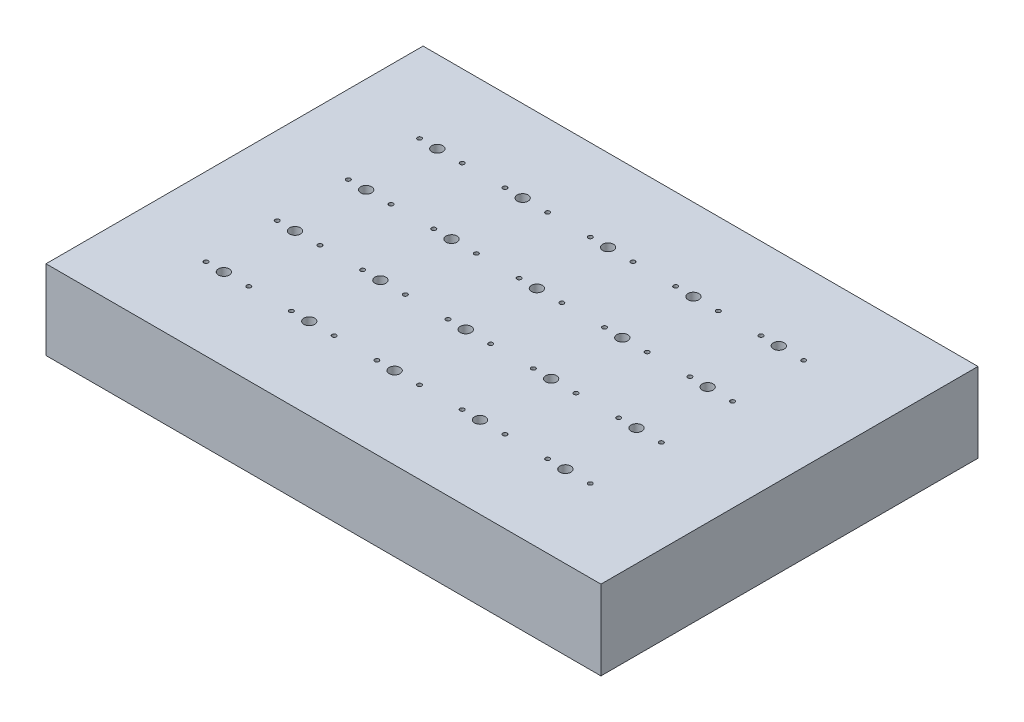
from build123d import *

# Parameters (mm, degrees)
BASEWITH_ALIGNMENT_W     = 70
BASEWITH_ALIGNMENT_H     = 45
BOSS_EXTRUDE1_DEPTH      = 3.175
BOSS_EXTRUDE2_DEPTH      = 3
SKETCH1_4_R              = 0.762
SKETCH1_4_R_2            = 0.3
CUT_EXTRUDE1_DEPTH       = 71.82605894
LPATTERN1_COUNT          = 4
LPATTERN1_PITCH          = 10
LPATTERN1_COUNT_DIR2     = 5
LPATTERN1_PITCH_DIR2     = 12
BOSS_EXTRUDE3_DEPTH      = 8
BOSS_EXTRUDE3_DEPTH_BACK = 3.175
SKETCH2_W                = 78
SKETCH2_H                = 53
SKETCH2_W_2              = 70
SKETCH2_H_2              = 45


with BuildPart() as part:
    # BaseWith Alignment → Boss-Extrude1 (new body)
    with BuildSketch(Plane(origin=(0, 0, 0), x_dir=(1, 0, 0), z_dir=(0, 1, 0))):
        with Locations((25, -15)):
            Rectangle(BASEWITH_ALIGNMENT_W, BASEWITH_ALIGNMENT_H)
    extrude(amount=BOSS_EXTRUDE1_DEPTH)

    # Sketch1 → Boss-Extrude2 (add)
    with BuildSketch(Plane(origin=(0, 0, 0), x_dir=(-1, 0, 0), z_dir=(0, -1, 0))):
        with BuildLine():
            Line((2.017857143, -1.961432458), (-3.110714286, -1.296526148))
            ThreePointArc((-3.110714286, -1.296526148), (-4.25, 0), (-3.110714286, 1.296526148))
            Line((-3.110714286, 1.296526148), (2.017857143, 1.961432458))
            ThreePointArc((2.017857143, 1.961432458), (4.25, 0), (2.017857143, -1.961432458))
        make_face()
    boss_extrude2 = extrude(amount=BOSS_EXTRUDE2_DEPTH)

    # Sketch1<4> → Cut-Extrude1 (cut, symmetric)
    with BuildSketch(Plane(origin=(0, 0, 0), x_dir=(-1, 0, 0), z_dir=(0, -1, 0))):
        with Locations(Location((0.5, 0, 0), (0, 0, 90))):
            Circle(SKETCH1_4_R)
        with Locations(Location((3, 0, 0), (0, 0, 90))):
            Circle(SKETCH1_4_R_2)
        with Locations(Location((-3, 0, 0), (0, 0, 90))):
            Circle(SKETCH1_4_R_2)
    cut_extrude1 = extrude(amount=CUT_EXTRUDE1_DEPTH, both=True, mode=Mode.SUBTRACT)

    # LPattern1: Boss-Extrude2, Cut-Extrude1 4 × 5
    with Locations(*[(j * LPATTERN1_PITCH_DIR2, 0, i * LPATTERN1_PITCH) for i in range(LPATTERN1_COUNT) for j in range(LPATTERN1_COUNT_DIR2) if (i, j) != (0, 0)]):
        add(boss_extrude2)
        add(cut_extrude1, mode=Mode.SUBTRACT)

    # Sketch2 → Boss-Extrude3 (add, two sides: drawn at the far end of the back side and taken through both)
    with BuildSketch(Plane.XZ.offset(-BOSS_EXTRUDE3_DEPTH_BACK)):
        with Locations((25, 15)):
            Rectangle(SKETCH2_W, SKETCH2_H)
        with Locations((25, 15)):
            Rectangle(SKETCH2_W_2, SKETCH2_H_2, mode=Mode.SUBTRACT)
    extrude(amount=BOSS_EXTRUDE3_DEPTH + BOSS_EXTRUDE3_DEPTH_BACK)


solid = part.part
